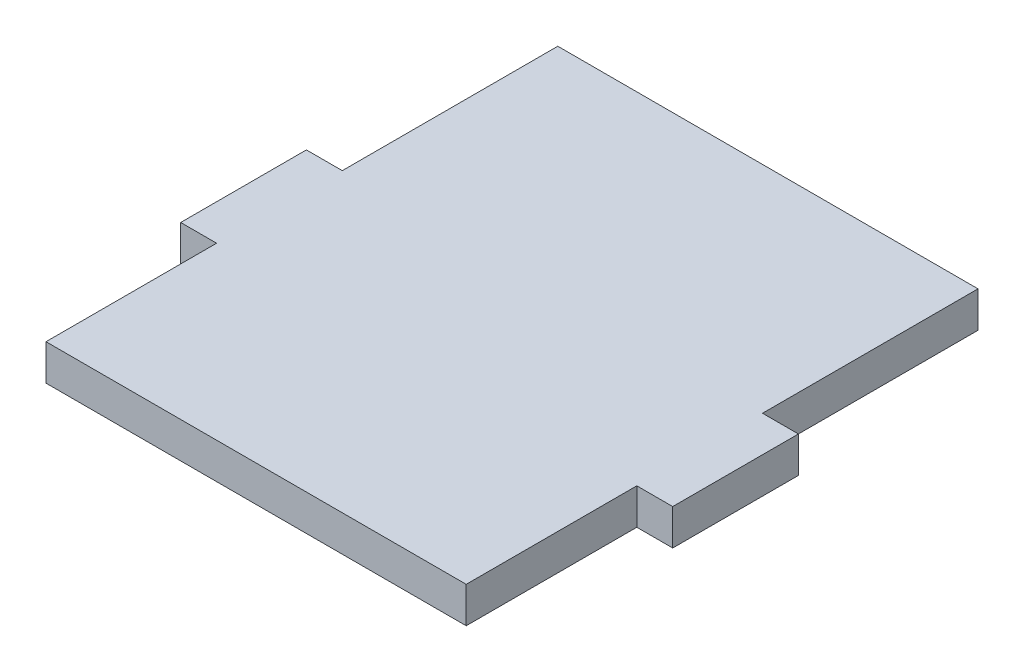
from build123d import *

# Parameters (mm, degrees)
SKETCH1_W           = 23.4
SKETCH1_H           = 28.5
SKETCH1_W_2         = 2
SKETCH1_H_2         = 7
BOSS_EXTRUDE1_DEPTH = 2


with BuildPart() as part:
    # Sketch1 → Boss-Extrude1 (new body)
    with BuildSketch(Plane(origin=(0, 0, 0), x_dir=(1, 0, 0), z_dir=(0, 1, 0))):
        Rectangle(SKETCH1_W, SKETCH1_H)
        with Locations((-12.7, -1.25)):
            Rectangle(SKETCH1_W_2, SKETCH1_H_2)
        with Locations((12.7, -1.25)):
            Rectangle(SKETCH1_W_2, SKETCH1_H_2)
    extrude(amount=BOSS_EXTRUDE1_DEPTH)


solid = part.part
